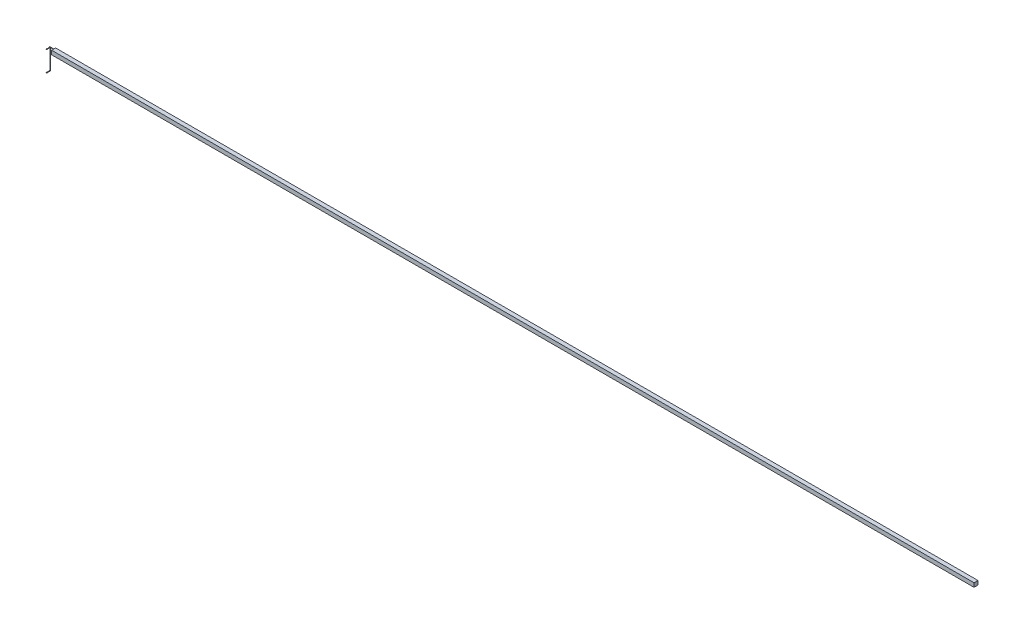
from build123d import *

# Parameters (mm, degrees)
ESQUISSE8_R        = 1.5
ESQUISSE9_W        = 3
ESQUISSE9_H        = 1
ESQUISSE11_R       = 1.5
ESQUISSE12_W       = 1
ESQUISSE12_H       = 3
ESQUISSE14_R       = 1.5
BOSS_EXTRU_4_DEPTH = 2.5
ESQUISSE15_W       = 30
ESQUISSE15_H       = 30
BOSS_EXTRU_5_DEPTH = 6960


with BuildPart() as part:
    # Balayage1: sweep along a path in Esquisse7
    with BuildLine(Plane(origin=(71, 86, 0), x_dir=(-1, 0, 0), z_dir=(0, -1, 0))) as balayage1_path:
        Line((-7001, 0), (-41, 0))
        Line((-41, 0), (-41, 15))
        Line((-41, 15), (-1, 15))
        Line((-1, 15), (-1, -15))
    # Esquisse8 → Balayage1 (sweep)
    with BuildSketch(Plane(origin=(72, 86, 15), x_dir=(1, 0, 0), z_dir=(0, 0, 1))):
        Circle(ESQUISSE8_R)
    sweep(path=balayage1_path.line, transition=Transition.RIGHT)

    # Esquisse9 → Révolution1 (revolve)
    with BuildSketch(Plane(origin=(71, 86, 0), x_dir=(-1, 0, 0), z_dir=(0, -1, 0)), mode=Mode.PRIVATE) as r_volution1_sk:
        with Locations((0.5, -10.5)):
            Rectangle(ESQUISSE9_W, ESQUISSE9_H)
        with Locations((0.5, 10.5)):
            Rectangle(ESQUISSE9_W, ESQUISSE9_H)
    revolve(r_volution1_sk.sketch.rotate(Axis((72, 86, 10), (0, 0, -1)), 180), axis=Axis((72, 86, 10), (0, 0, -1)))

    # Balayage2: sweep along a path in Esquisse10
    with BuildLine(Plane(origin=(71, 0, 0), x_dir=(0, 0, -1), z_dir=(1, 0, 0))) as balayage2_path:
        Line((-15, -68), (15, -68))
        Line((15, -68), (15, 86))
    # Esquisse11 → Balayage2 (sweep)
    with BuildSketch(Plane(origin=(71, -68, 15), x_dir=(-1, 0, 0), z_dir=(0, 0, -1))):
        Circle(ESQUISSE11_R)
    sweep(path=balayage2_path.line, transition=Transition.RIGHT)

    # Esquisse12 → Révolution2 (revolve)
    with BuildSketch(Plane(origin=(71, 0, 0), x_dir=(0, 0, -1), z_dir=(1, 0, 0))):
        with Locations((9.5, -66.5)):
            Rectangle(ESQUISSE12_W, ESQUISSE12_H)
        with Locations((-9.5, -66.5)):
            Rectangle(ESQUISSE12_W, ESQUISSE12_H)
    revolve(axis=Axis((71, -68, -10), (0, 0, 1)))

    # Esquisse14 → Boss.-Extru.4 (add, symmetric)
    with BuildSketch(Plane(origin=(71, 0, 0), x_dir=(0, 0, -1), z_dir=(1, 0, 0))):
        with Locations((15, 86)):
            Circle(ESQUISSE14_R)
    extrude(amount=BOSS_EXTRU_4_DEPTH, both=True)

    # Esquisse15 → Boss.-Extru.5 (add)
    with BuildSketch(Plane(origin=(7072, 0, 0), x_dir=(0, 0, -1), z_dir=(1, 0, 0))):
        with Locations((0, 86)):
            Rectangle(ESQUISSE15_W, ESQUISSE15_H)
    extrude(amount=-BOSS_EXTRU_5_DEPTH)


solid = part.part
